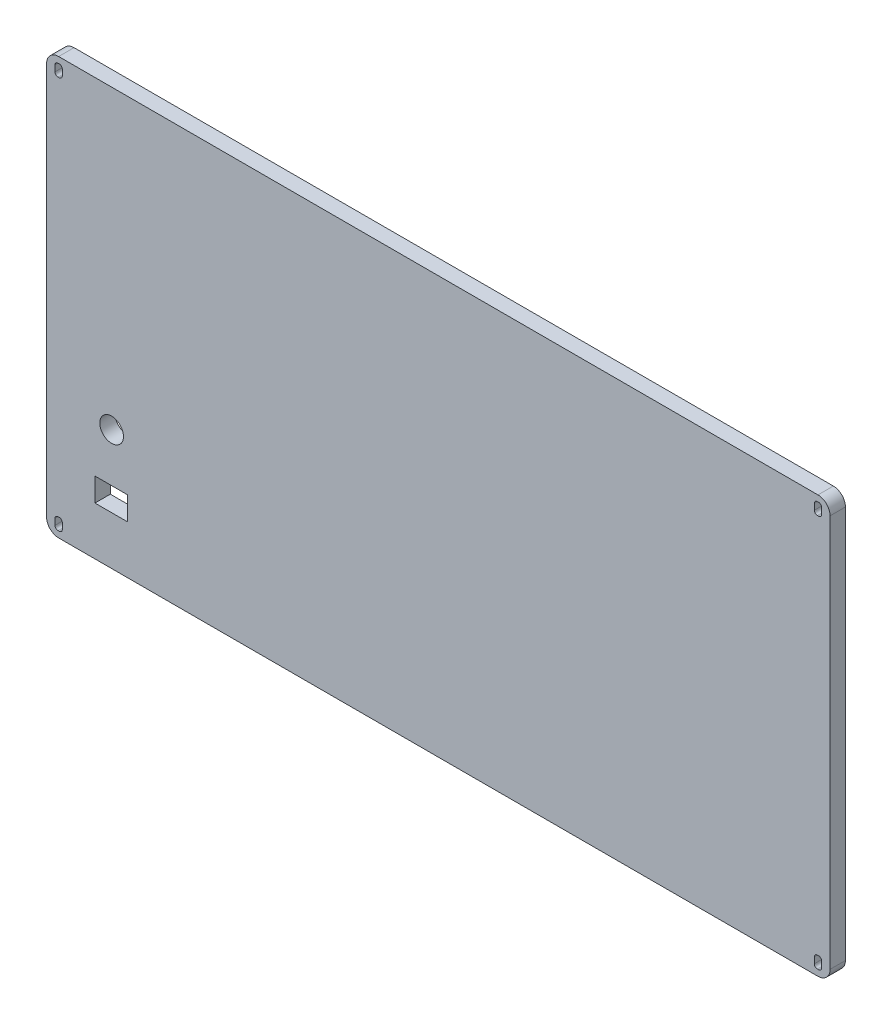
from build123d import *

# Parameters (mm, degrees)
SKETCH1_W           = 647.7
SKETCH1_H           = 344.678
SKETCH1_R           = 9.779
SKETCH1_W_2         = 27.1018
SKETCH1_H_2         = 19.3548
BOSS_EXTRUDE1_DEPTH = 12.7
FILLET1_R           = 10
FILLET2_R           = 10


with BuildPart() as part:
    # Sketch1 → Boss-Extrude1 (new body)
    with BuildSketch(Plane.XY):
        with Locations((25.51036036, -39.985171171)):
            Rectangle(SKETCH1_W, SKETCH1_H)
        with Locations((-244.559967776, -112.969371171)):
            Circle(SKETCH1_R, mode=Mode.SUBTRACT)
        with BuildLine():
            Line((339.86036036, -207.324171171), (338.86036036, -207.324171171))
            ThreePointArc((338.86036036, -207.324171171), (337.092593407, -206.591938124), (336.36036036, -204.824171171))
            Line((336.36036036, -204.824171171), (336.36036036, -199.824171171))
            ThreePointArc((336.36036036, -199.824171171), (337.092593407, -198.056404218), (338.86036036, -197.324171171))
            Line((338.86036036, -197.324171171), (339.86036036, -197.324171171))
            ThreePointArc((339.86036036, -197.324171171), (341.628127313, -198.056404218), (342.36036036, -199.824171171))
            Line((342.36036036, -199.824171171), (342.36036036, -204.824171171))
            ThreePointArc((342.36036036, -204.824171171), (341.628127313, -206.591938124), (339.86036036, -207.324171171))
        make_face(mode=Mode.SUBTRACT)
        with BuildLine():
            Line((-287.83963964, -207.324171171), (-288.83963964, -207.324171171))
            ThreePointArc((-288.83963964, -207.324171171), (-290.607406593, -206.591938124), (-291.33963964, -204.824171171))
            Line((-291.33963964, -204.824171171), (-291.33963964, -199.824171171))
            ThreePointArc((-291.33963964, -199.824171171), (-290.607406593, -198.056404218), (-288.83963964, -197.324171171))
            Line((-288.83963964, -197.324171171), (-287.83963964, -197.324171171))
            ThreePointArc((-287.83963964, -197.324171171), (-286.071872687, -198.056404218), (-285.33963964, -199.824171171))
            Line((-285.33963964, -199.824171171), (-285.33963964, -204.824171171))
            ThreePointArc((-285.33963964, -204.824171171), (-286.071872687, -206.591938124), (-287.83963964, -207.324171171))
        make_face(mode=Mode.SUBTRACT)
        with BuildLine():
            Line((-287.83963964, 117.355828829), (-288.83963964, 117.355828829))
            ThreePointArc((-288.83963964, 117.355828829), (-290.607406593, 118.088061876), (-291.33963964, 119.855828829))
            Line((-291.33963964, 119.855828829), (-291.33963964, 124.855828829))
            ThreePointArc((-291.33963964, 124.855828829), (-290.607406593, 126.623595782), (-288.83963964, 127.355828829))
            Line((-288.83963964, 127.355828829), (-287.83963964, 127.355828829))
            ThreePointArc((-287.83963964, 127.355828829), (-286.071872687, 126.623595782), (-285.33963964, 124.855828829))
            Line((-285.33963964, 124.855828829), (-285.33963964, 119.855828829))
            ThreePointArc((-285.33963964, 119.855828829), (-286.071872687, 118.088061876), (-287.83963964, 117.355828829))
        make_face(mode=Mode.SUBTRACT)
        with BuildLine():
            Line((339.86036036, 117.355828829), (338.86036036, 117.355828829))
            ThreePointArc((338.86036036, 117.355828829), (337.092593407, 118.088061876), (336.36036036, 119.855828829))
            Line((336.36036036, 119.855828829), (336.36036036, 124.855828829))
            ThreePointArc((336.36036036, 124.855828829), (337.092593407, 126.623595782), (338.86036036, 127.355828829))
            Line((338.86036036, 127.355828829), (339.86036036, 127.355828829))
            ThreePointArc((339.86036036, 127.355828829), (341.628127313, 126.623595782), (342.36036036, 124.855828829))
            Line((342.36036036, 124.855828829), (342.36036036, 119.855828829))
            ThreePointArc((342.36036036, 119.855828829), (341.628127313, 118.088061876), (339.86036036, 117.355828829))
        make_face(mode=Mode.SUBTRACT)
        with Locations((-244.78873964, -162.646771171)):
            Rectangle(SKETCH1_W_2, SKETCH1_H_2, mode=Mode.SUBTRACT)
    extrude(amount=BOSS_EXTRUDE1_DEPTH)

    # Fillet1
    fillet1_edges = [part.edges().sort_by_distance(p)[0] for p in [
        (-298.33963964, 132.353828829, 6.35),
        (349.36036036, 132.353828829, 6.35),
        (349.36036036, -212.324171171, 6.35),
    ]]
    fillet(fillet1_edges, radius=FILLET1_R)

    # Fillet2
    fillet2_edges = [part.edges().sort_by_distance(p)[0] for p in [
        (-298.33963964, -212.324171171, 6.35),
    ]]
    fillet(fillet2_edges, radius=FILLET2_R)


solid = part.part
